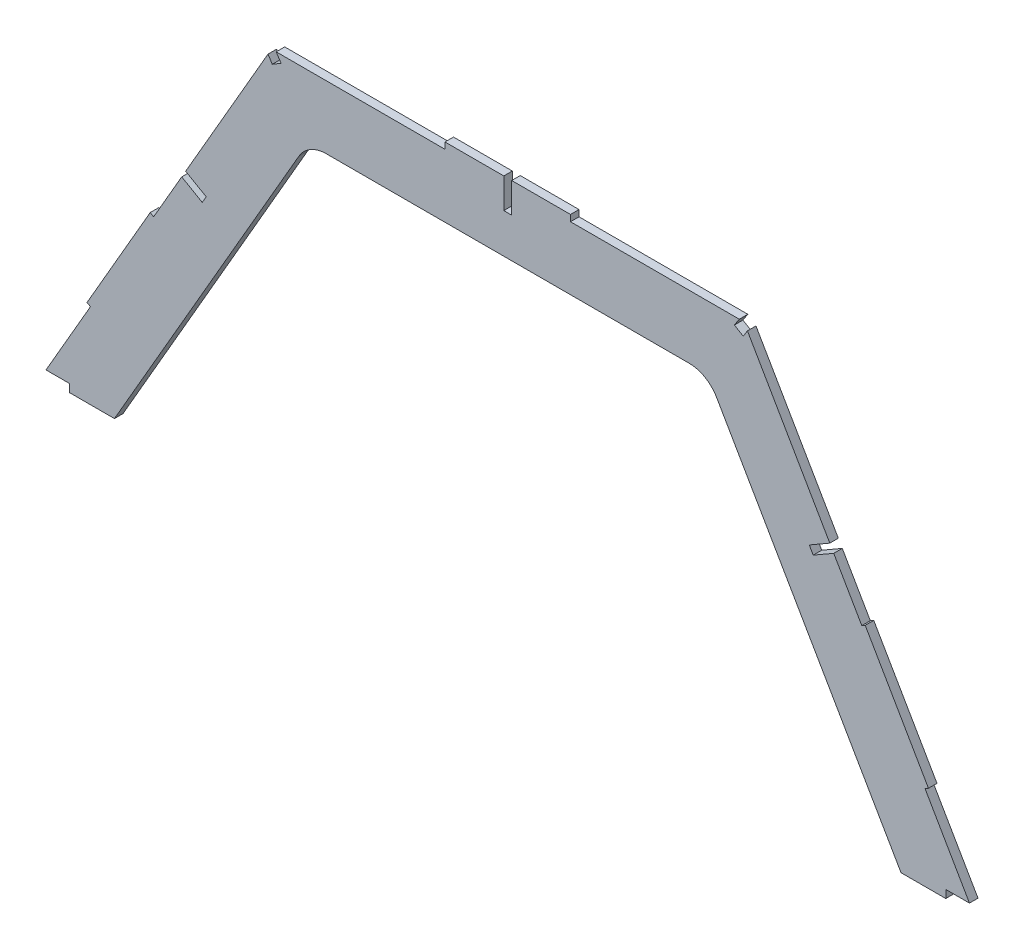
from build123d import *

# Parameters (mm, degrees)
BOSS_EXTRUDE1_DEPTH      = 3.175
BOSS_EXTRUDE1_DEPTH_BACK = 0.254
FILLET1_R                = 12.7
SKETCH3_W                = 50.8
SKETCH3_H                = 1.5875
BOSS_EXTRUDE2_DEPTH      = 3.429
CUT_EXTRUDE1_DEPTH       = 305.703453695
CUT_EXTRUDE2_DEPTH       = 305.703453695
CUT_EXTRUDE4_DEPTH       = 305.048068156
BOSS_EXTRUDE3_DEPTH      = 3.175
FILLET2_R                = 12.7
CUT_EXTRUDE5_REACH       = 237.529
SKETCH10_W               = 3.175
SKETCH10_H               = 9.525
SKETCH12_W               = 23.622
SKETCH12_H               = 3.175
BOSS_EXTRUDE4_DEPTH      = 2.54
SKETCH15_W               = 463.920025393
SKETCH15_H               = 26.613528777
CUT_EXTRUDE8_DEPTH       = 237.949226834
BOSS_EXTRUDE5_DEPTH      = 3.429
SKETCH17_W               = 23.622
SKETCH17_H               = 2.54
BOSS_EXTRUDE6_DEPTH      = 3.429
SKETCH18_W               = 3.175
SKETCH18_H               = 3.429
CUT_EXTRUDE9_DEPTH       = 9.525
CUT_EXTRUDE10_DEPTH      = 258.887018005
FILLET3_R                = 12.7
CUT_EXTRUDE11_DEPTH      = 258.887018005


with BuildPart() as part:
    # Sketch1 → Boss-Extrude1 (new, two sides: drawn at the far end of the back side and taken through both)
    with BuildSketch(Plane.XY.offset(-BOSS_EXTRUDE1_DEPTH_BACK)):
        Polygon((-196.85, 0), (-63.5, 230.968975189), (63.5, 230.968975189), (196.85, 0), (167.520606325, 0), (48.835303163, 205.568975189), (-48.835303163, 205.568975189), (-167.520606325, 0), align=None)
    extrude(amount=BOSS_EXTRUDE1_DEPTH + BOSS_EXTRUDE1_DEPTH_BACK)

    # Fillet1
    fillet1_edges = [part.edges().sort_by_distance(p)[0] for p in [
        (167.520606325, 0, 1.4605),
        (48.835303163, 205.568975189, 1.4605),
        (-48.835303163, 205.568975189, 1.4605),
        (-167.520606325, 0, 1.4605),
    ]]
    fillet(fillet1_edges, radius=FILLET1_R)

    # Sketch3 → Boss-Extrude2 (add)
    with BuildSketch(Plane(origin=(0, 0, -0.254), x_dir=(-1, 0, 0), z_dir=(0, 0, -1))):
        Polygon((81.638815329, 202.726625451), (80.264, 201.932875451), (105.664, 157.938784939), (107.038815329, 158.732534939), align=None)
        Polygon((143.614815329, 95.381044601), (142.24, 94.587294601), (167.64, 50.593204089), (169.014815329, 51.386954089), align=None)
        with Locations((0, 231.762725189)):
            Rectangle(SKETCH3_W, SKETCH3_H)
    boss_extrude2 = extrude(amount=-BOSS_EXTRUDE2_DEPTH)

    # Sketch5 → Cut-Extrude1 (cut, through all)
    with BuildSketch(Plane(origin=(0, 0, -0.254), x_dir=(-1, 0, 0), z_dir=(0, 0, -1))):
        Polygon((-175.966912895, 19.672783942), (-185.491912895, 19.672783942), (-187.325, 16.497783942), (-186.309, 16.497783942), (-175.966912895, 16.497783942), align=None)
        Polygon((-186.309, 16.497783942), (-187.325, 16.497783942), (-196.85, 0), (-195.834, 0), align=None)
        Polygon((-121.132358029, 112.096802923), (-129.38125, 116.859302923), (-130.96875, 114.109672266), (-122.719858029, 109.347172266), align=None)
    cut_extrude1 = extrude(amount=-CUT_EXTRUDE1_DEPTH, mode=Mode.SUBTRACT)

    # Sketch4 → Cut-Extrude2 (cut, through all)
    with BuildSketch(Plane(origin=(0, 0, -0.254), x_dir=(-1, 0, 0), z_dir=(0, 0, -1))):
        Polygon((-61.666912895, 230.968975189), (-56.904412895, 222.720083218), (-59.654043552, 221.132583218), (-64.416543552, 229.381475189), (-63.5, 230.968975189), align=None)
    cut_extrude2 = extrude(amount=-CUT_EXTRUDE2_DEPTH, mode=Mode.SUBTRACT)

    # Mirror1: Boss-Extrude2, Cut-Extrude1, Cut-Extrude2 across plane
    add(boss_extrude2.mirror(Plane(origin=(0, 0, 0), x_dir=(0, 0, 1), z_dir=(1, 0, 0))))
    add(cut_extrude1.mirror(Plane(origin=(0, 0, 0), x_dir=(0, 0, 1), z_dir=(1, 0, 0))), mode=Mode.SUBTRACT)
    add(cut_extrude2.mirror(Plane(origin=(0, 0, 0), x_dir=(0, 0, 1), z_dir=(1, 0, 0))), mode=Mode.SUBTRACT)

    # Sketch6 → Cut-Extrude4 (cut, through all)
    with BuildSketch(Plane(origin=(0, 0, -0.254), x_dir=(-1, 0, 0), z_dir=(0, 0, -1))):
        Polygon((-121.326811287, 130.81), (-91.997417612, 130.81), (-52.501477372, 199.218975189), (-41.502954744, 205.568975189), (41.502954744, 205.568975189), (47.852954744, 203.867497817), (52.501477372, 199.218975189), (91.997417612, 130.81), (121.326811287, 130.81), (105.664, 157.938784939), (107.038815329, 158.732534939), (81.638815329, 202.726625451), (80.264, 201.932875451), (64.416543552, 229.381475189), (59.654043552, 221.132583218), (56.904412895, 222.720083218), (61.666912895, 230.968975189), (25.4, 230.968975189), (25.4, 232.556475189), (-25.4, 232.556475189), (-25.4, 230.968975189), (-61.666912895, 230.968975189), (-56.904412895, 222.720083218), (-59.654043552, 221.132583218), (-64.416543552, 229.381475189), (-80.264, 201.932875451), (-81.638815329, 202.726625451), (-107.038815329, 158.732534939), (-105.664, 157.938784939), align=None)
    extrude(amount=-CUT_EXTRUDE4_DEPTH, mode=Mode.SUBTRACT)


with BuildPart() as cut_extrude4_piece_1:
    # of the separate pieces the step leaves, piece 1, a body of its own (cut_extrude4_pieces)
    add(part.part.solids().sort_by_distance((-174.852954744, 0, -0.254))[0])



with BuildPart() as cut_extrude4_piece_2:
    # of the separate pieces the step leaves, piece 2, a body of its own (cut_extrude4_pieces)
    add(part.part.solids().sort_by_distance((195.834, 0, -0.254))[0])


with BuildPart() as cut_extrude4_piece_1_1:
    add(cut_extrude4_piece_1.part)

    add(cut_extrude4_piece_2.part)  # Boss-Extrude3 merges Cut-Extrude4 piece 2
    # Sketch9 → Boss-Extrude3 (add)
    with BuildSketch(Plane(origin=(0, 0, -0.254), x_dir=(-1, 0, 0), z_dir=(0, 0, -1))):
        Polygon((-91.997417612, 130.81), (-106.66211445, 105.41), (106.66211445, 105.41), (91.997417612, 130.81), align=None)
    extrude(amount=-BOSS_EXTRUDE3_DEPTH)

    # Fillet2
    fillet2_edges = [cut_extrude4_piece_1_1.edges().sort_by_distance(p)[0] for p in [
        (-106.66211445, 105.41, 1.3335),
        (106.66211445, 105.41, 1.3335),
    ]]
    fillet(fillet2_edges, radius=FILLET2_R)

    # Sketch10 → Cut-Extrude5 (cut, up to next)
    with BuildSketch(Plane(origin=(0, 0, -0.254), x_dir=(-1, 0, 0), z_dir=(0, 0, -1)), mode=Mode.PRIVATE) as cut_extrude5_sk1:
        with Locations((0, 126.0475)):
            Rectangle(SKETCH10_W, SKETCH10_H)
    cut_extrude5_tool1 = extrude(cut_extrude5_sk1.sketch, amount=-CUT_EXTRUDE5_REACH, mode=Mode.PRIVATE) & cut_extrude4_piece_1_1.part
    add(cut_extrude5_tool1.solids().sort_by_distance((0, 126.0475, -0.254))[0], mode=Mode.SUBTRACT)

    # Sketch12 → Boss-Extrude4 (add)
    with BuildSketch(Plane(origin=(0, 130.81, 0), x_dir=(1, 0, 0), z_dir=(0, 1, 0))):
        with Locations((13.3985, -1.3335)):
            Rectangle(SKETCH12_W, SKETCH12_H)
        with Locations((-13.3985, -1.3335)):
            Rectangle(SKETCH12_W, SKETCH12_H)
    extrude(amount=BOSS_EXTRUDE4_DEPTH)

    # Sketch15 → Cut-Extrude8 (cut, through all)
    with BuildSketch(Plane(origin=(0, 0, -0.254), x_dir=(-1, 0, 0), z_dir=(0, 0, -1))):
        with Locations((4.62960925, 3.191019554)):
            Rectangle(SKETCH15_W, SKETCH15_H)
    extrude(amount=-CUT_EXTRUDE8_DEPTH, mode=Mode.SUBTRACT)

    # Sketch16 → Boss-Extrude5 (add)
    with BuildSketch(Plane(origin=(0, 0, -0.254), x_dir=(-1, 0, 0), z_dir=(0, 0, -1))):
        Polygon((-121.326811287, 130.81), (-94.897086805, 176.587625634), (94.897086805, 176.587625634), (121.326811287, 130.81), (91.997417612, 130.81), (80.232389968, 151.187625634), (-80.232389968, 151.187625634), (-91.997417612, 130.81), align=None)
    extrude(amount=-BOSS_EXTRUDE5_DEPTH)

    # Sketch17 → Boss-Extrude6 (add)
    with BuildSketch(Plane(origin=(0, 0, -0.254), x_dir=(-1, 0, 0), z_dir=(0, 0, -1))):
        with Locations((-13.3985, 177.857625634)):
            Rectangle(SKETCH17_W, SKETCH17_H)
        with Locations((13.3985, 177.857625634)):
            Rectangle(SKETCH17_W, SKETCH17_H)
    extrude(amount=-BOSS_EXTRUDE6_DEPTH)

    # Sketch18 → Cut-Extrude9 (cut)
    with BuildSketch(Plane(origin=(0, 176.587625634, 0), x_dir=(1, 0, 0), z_dir=(0, 1, 0))):
        with Locations((0, -1.4605)):
            Rectangle(SKETCH18_W, SKETCH18_H)
    extrude(amount=-CUT_EXTRUDE9_DEPTH, mode=Mode.SUBTRACT)

    # Sketch19 → Cut-Extrude10 (cut, through all)
    with BuildSketch(Plane(origin=(0, 0, -0.254), x_dir=(-1, 0, 0), z_dir=(0, 0, -1))):
        Polygon((-134.161947492, 57.778891971), (-86.11490379, 140.998812817), (86.11490379, 140.998812817), (134.161947492, 57.778891971), align=None)
    extrude(amount=-CUT_EXTRUDE10_DEPTH, mode=Mode.SUBTRACT)

    # Fillet3
    fillet3_edges = [cut_extrude4_piece_1_1.edges().sort_by_distance(p)[0] for p in [
        (-80.232389968, 151.187625634, 1.4605),
        (80.232389968, 151.187625634, 1.4605),
    ]]
    fillet(fillet3_edges, radius=FILLET3_R)

    # Sketch20 → Cut-Extrude11 (cut, through all)
    with BuildSketch(Plane(origin=(0, 0, -0.254), x_dir=(-1, 0, 0), z_dir=(0, 0, -1))):
        Polygon((93.018969857, 176.587625634), (91.060249362, 173.574435836), (94.601370403, 171.459929994), (96.297026346, 174.162859221), (94.897086805, 176.587625634), align=None)
        Polygon((-94.897086805, 176.587625634), (-96.297026346, 174.162859221), (-94.601370403, 171.459929994), (-91.060249362, 173.574435836), (-93.018969857, 176.587625634), align=None)
    extrude(amount=-CUT_EXTRUDE11_DEPTH, mode=Mode.SUBTRACT)


solid = cut_extrude4_piece_1_1.part
